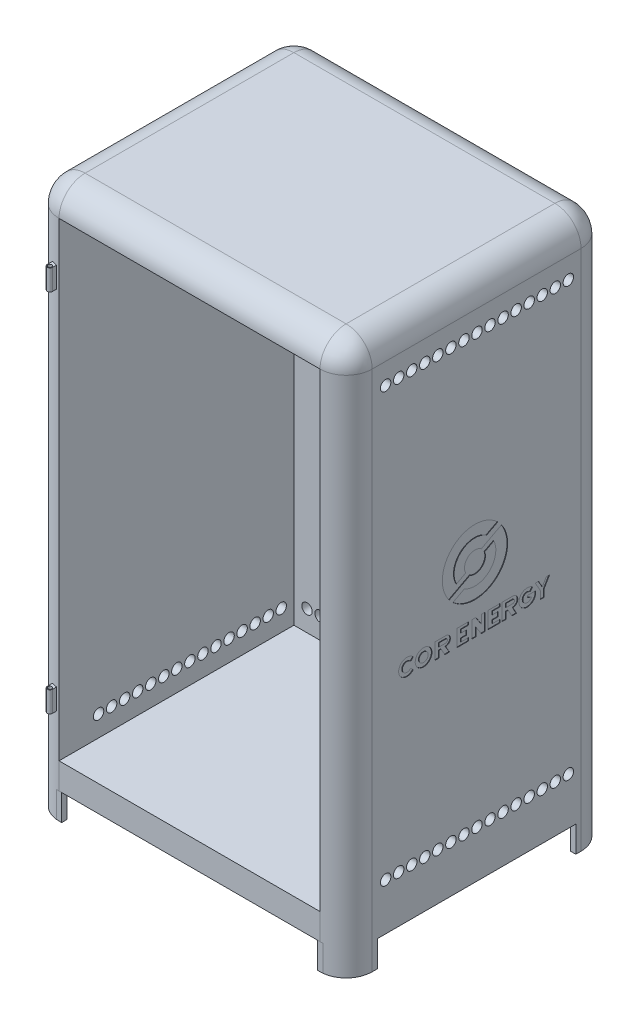
from build123d import *

# Parameters (mm, degrees)
BOSS_EXTRUDE1_DEPTH = 500
FILLET1_R           = 50
SKETCH2_W           = 500
SKETCH2_H           = 900
CUT_EXTRUDE1_DEPTH  = 450
BOSS_EXTRUDE2_START = -5
SKETCH3_W           = 27.5
SKETCH3_H           = 40
BOSS_EXTRUDE2_DEPTH = 10
BOSS_EXTRUDE4_DEPTH = 40
SKETCH6_R           = 3.75
CUT_EXTRUDE2_DEPTH  = 40
BOSS_EXTRUDE5_DEPTH = 50
SKETCH7_R           = 16.002178121
SKETCH7_R_2         = 8.764893155
CUT_EXTRUDE3_DEPTH  = 1
SKETCH8_R           = 10
CUT_EXTRUDE4_DEPTH  = 856.222924155
SKETCH9_R           = 10
CUT_EXTRUDE5_DEPTH  = 810.417228628


with BuildPart() as part:
    # Sketch1 → Boss-Extrude1 (new, symmetric)
    with BuildSketch(Plane(origin=(0, 0, 0), x_dir=(1, 0, 0), z_dir=(0, 1, 0))):
        with BuildLine():
            Line((250, -250), (-250, -250))
            ThreePointArc((-250, -250), (-285.355339059, -235.355339059), (-300, -200))
            Line((-300, -200), (-300, 200))
            ThreePointArc((-300, 200), (-285.355339059, 235.355339059), (-250, 250))
            Line((-250, 250), (250, 250))
            ThreePointArc((250, 250), (285.355339059, 235.355339059), (300, 200))
            Line((300, 200), (300, -200))
            ThreePointArc((300, -200), (285.355339059, -235.355339059), (250, -250))
        make_face()
    extrude(amount=BOSS_EXTRUDE1_DEPTH, both=True)

    # Fillet1
    fillet1_edges = [part.edges().sort_by_distance(p)[0] for p in [
        (285.355339059, 500, -235.355339059),
        (0, 500, -250),
        (-285.355339059, 500, -235.355339059),
        (-300, 500, 0),
        (-285.355339059, 500, 235.355339059),
        (0, 500, 250),
        (285.355339059, 500, 235.355339059),
        (300, 500, 0),
    ]]
    fillet(fillet1_edges, radius=FILLET1_R)

    # Sketch2 → Cut-Extrude1 (cut)
    with BuildSketch(Plane.XY.offset(250)):
        Rectangle(SKETCH2_W, SKETCH2_H)
    extrude(amount=-CUT_EXTRUDE1_DEPTH, mode=Mode.SUBTRACT)

    # Sketch3 → Boss-Extrude2 (add)
    with BuildSketch(Plane(origin=(-250, 0, 0), x_dir=(0, 0, -1), z_dir=(1, 0, 0)).offset(BOSS_EXTRUDE2_START)):
        with Locations((-243.75, 350)):
            Rectangle(SKETCH3_W, SKETCH3_H)
    boss_extrude2 = extrude(amount=-BOSS_EXTRUDE2_DEPTH)

    # Sketch5 → Boss-Extrude4 (add)
    with BuildSketch(Plane(origin=(0, 370, 0), x_dir=(1, 0, 0), z_dir=(0, 1, 0))):
        with BuildLine():
            Line((-265, -257.5), (-265, -252.5))
            Line((-265, -252.5), (-255, -252.5))
            Line((-255, -252.5), (-255, -257.5))
            ThreePointArc((-255, -257.5), (-260, -262.5), (-265, -257.5))
        make_face()
    boss_extrude4 = extrude(amount=-BOSS_EXTRUDE4_DEPTH)

    # Sketch6 → Cut-Extrude2 (cut)
    with BuildSketch(Plane(origin=(0, 370, 0), x_dir=(1, 0, 0), z_dir=(0, 1, 0))):
        with Locations(Location((-260, -257.5, 0), (0, 0, 270))):
            Circle(SKETCH6_R)
    cut_extrude2 = extrude(amount=-CUT_EXTRUDE2_DEPTH, mode=Mode.SUBTRACT)

    # Mirror1: Boss-Extrude2, Boss-Extrude4, Cut-Extrude2 across plane
    add(boss_extrude2.mirror(Plane.ZX))
    add(boss_extrude4.mirror(Plane.ZX))
    add(cut_extrude2.mirror(Plane.ZX), mode=Mode.SUBTRACT)

    # Sketch4 → Boss-Extrude5 (add)
    with BuildSketch(Plane.XZ.offset(500)):
        with BuildLine():
            Line((-300, 200), (-300, 190))
            Line((-300, 190), (-290, 190))
            Line((-290, 190), (-290, 200))
            ThreePointArc((-290, 200), (-278.284271247, 228.284271247), (-250, 240))
            Line((-250, 240), (-245.003141217, 240))
            Line((-245.003141217, 240), (-245.003141217, 250))
            Line((-245.003141217, 250), (-255, 249.749371855))
            ThreePointArc((-255, 249.749371855), (-287.080992435, 233.541019662), (-300, 200))
        make_face()
        with BuildLine():
            Line((290, 190), (300, 190))
            Line((300, 190), (300, 200))
            ThreePointArc((300, 200), (287.080992435, 233.541019662), (255, 249.749371855))
            Line((255, 249.749371855), (245.003141217, 250))
            Line((245.003141217, 250), (245.003141217, 240))
            Line((245.003141217, 240), (250, 240))
            ThreePointArc((250, 240), (278.284271247, 228.284271247), (290, 200))
            Line((290, 200), (290, 190))
        make_face()
        with BuildLine():
            Line((300, -200), (300, -190))
            Line((300, -190), (290, -190))
            Line((290, -190), (290, -200))
            ThreePointArc((290, -200), (278.284271247, -228.284271247), (250, -240))
            Line((250, -240), (245.003141217, -240))
            Line((245.003141217, -240), (245.003141217, -250))
            Line((245.003141217, -250), (255, -249.749371855))
            ThreePointArc((255, -249.749371855), (287.080992435, -233.541019662), (300, -200))
        make_face()
        with BuildLine():
            Line((-255, -249.749371855), (-245.003141217, -250))
            Line((-245.003141217, -250), (-245.003141217, -240))
            Line((-245.003141217, -240), (-250, -240))
            ThreePointArc((-250, -240), (-278.284271247, -228.284271247), (-290, -200))
            Line((-290, -200), (-290, -190))
            Line((-290, -190), (-300, -190))
            Line((-300, -190), (-300, -200))
            ThreePointArc((-300, -200), (-287.080992435, -233.541019662), (-255, -249.749371855))
        make_face()
    extrude(amount=BOSS_EXTRUDE5_DEPTH)

    # Sketch7 → Cut-Extrude3 (cut)
    # profile 1 of 10: a face of its own
    with BuildSketch(Plane(origin=(300, 0, 0), x_dir=(0, 0, -1), z_dir=(1, 0, 0))):
        with Locations((-101.62512665, -77.408667629)):
            Circle(SKETCH7_R)
        with Locations((-101.62512665, -77.408667629)):
            Circle(SKETCH7_R_2, mode=Mode.SUBTRACT)
    # profile 2 of 10: a face of its own
    with BuildSketch(Plane(origin=(300, 0, 0), x_dir=(0, 0, -1), z_dir=(1, 0, 0))):
        with BuildLine():
            Line((-79.919015614, -62.785778955), (-79.919015614, -93.41084575))
            Line((-79.919015614, -93.41084575), (-72.419015614, -93.41084575))
            Line((-72.419015614, -93.41084575), (-72.419015614, -80.59834575))
            Line((-72.419015614, -80.59834575), (-68.019625147, -80.59834575))
            Line((-68.019625147, -80.59834575), (-60.84333251, -93.41084575))
            Line((-60.84333251, -93.41084575), (-52.09333251, -93.41084575))
            Line((-52.09333251, -93.41084575), (-59.269625147, -80.59834575))
            ThreePointArc((-59.269625147, -80.59834575), (-50.363341749, -71.692062352), (-59.269625147, -62.785778955))
            Line((-59.269625147, -62.785778955), (-79.919015614, -62.785778955))
        make_face()
        with BuildLine():
            Line((-59.269625147, -75.09834575), (-72.419015614, -75.09834575))
            Line((-72.419015614, -75.09834575), (-72.419015614, -68.285778955))
            Line((-72.419015614, -68.285778955), (-59.269625147, -68.285778955))
            ThreePointArc((-59.269625147, -68.285778955), (-55.863341749, -71.692062352), (-59.269625147, -75.09834575))
        make_face(mode=Mode.SUBTRACT)
    # profile 3 of 10: a face of its own
    with BuildSketch(Plane(origin=(300, 0, 0), x_dir=(0, 0, -1), z_dir=(1, 0, 0))):
        Polygon((-18.957125147, -73.033667629), (-18.957125147, -81.783667629), (-29.894625147, -81.783667629), (-29.894625147, -87.777171882), (-15.207125147, -87.777171882), (-15.207125147, -93.41084575), (-37.707125147, -93.41084575), (-37.707125147, -61.406489508), (-15.207125147, -61.406489508), (-15.207125147, -67.040163376), (-29.894625147, -67.040163376), (-29.894625147, -73.033667629), align=None)
    # profile 4 of 10: a face of its own
    with BuildSketch(Plane(origin=(300, 0, 0), x_dir=(0, 0, -1), z_dir=(1, 0, 0))):
        Polygon((44.669753756, -93.41084575), (44.669753756, -87.535225783), (29.982253756, -87.535225783), (29.982253756, -81.54172153), (40.919753756, -81.54172153), (40.919753756, -72.79172153), (29.982253756, -72.79172153), (29.982253756, -66.798217277), (44.669753756, -66.798217277), (44.669753756, -61.406489508), (22.169753756, -61.406489508), (22.169753756, -93.41084575), align=None)
    # profile 5 of 10: a face of its own
    with BuildSketch(Plane(origin=(300, 0, 0), x_dir=(0, 0, -1), z_dir=(1, 0, 0))):
        with BuildLine():
            Line((67.61708546, -93.41084575), (60.440792823, -80.59834575))
            Line((60.440792823, -80.59834575), (56.041402355, -80.59834575))
            Line((56.041402355, -80.59834575), (56.041402355, -93.41084575))
            Line((56.041402355, -93.41084575), (48.541402355, -93.41084575))
            Line((48.541402355, -93.41084575), (48.541402355, -61.335572011))
            Line((48.541402355, -61.335572011), (69.190792823, -61.335572011))
            ThreePointArc((69.190792823, -61.335572011), (78.822179692, -70.966958881), (69.190792823, -80.59834575))
            Line((69.190792823, -80.59834575), (76.36708546, -93.41084575))
            Line((76.36708546, -93.41084575), (67.61708546, -93.41084575))
        make_face()
        with BuildLine():
            Line((69.190792823, -73.854137749), (56.041402355, -73.854137749))
            Line((56.041402355, -73.854137749), (56.041402355, -67.041570954))
            Line((56.041402355, -67.041570954), (69.190792823, -67.041570954))
            ThreePointArc((69.190792823, -67.041570954), (72.597076221, -70.447854352), (69.190792823, -73.854137749))
        make_face(mode=Mode.SUBTRACT)
    # profile 6 of 10: a face of its own
    with BuildSketch(Plane(origin=(300, 0, 0), x_dir=(0, 0, -1), z_dir=(1, 0, 0))):
        Polygon((-8.953859328, -61.406489508), (-1.453859328, -61.406489508), (8.996860653, -77.408667629), (8.996860653, -61.404963748), (16.496860653, -61.404963748), (16.496860653, -93.41084575), (8.996860653, -93.41084575), (-1.453859328, -77.408667629), (-1.453859328, -93.41084575), (-8.953859328, -93.41084575), align=None)
    # profile 7 of 10: a face of its own
    with BuildSketch(Plane(origin=(300, 0, 0), x_dir=(0, 0, -1), z_dir=(1, 0, 0))):
        with BuildLine():
            Line((97.070626041, -77.408667629), (105.01106712, -80.892653845))
            ThreePointArc((105.01106712, -80.892653845), (88.641715559, -79.443915173), (102.546372912, -70.685204184))
            Line((102.546372912, -70.685204184), (107.175851083, -65.000842217))
            ThreePointArc((107.175851083, -65.000842217), (82.617679703, -84.277586523), (113.072804162, -77.408667629))
            ThreePointArc((113.072804162, -77.408667629), (112.996688878, -75.849749051), (112.769067119, -74.305660645))
            Line((112.769067119, -74.305660645), (97.070626041, -74.305660645))
            Line((97.070626041, -74.305660645), (97.070626041, -77.408667629))
        make_face()
    # profile 8 of 10: a face of its own
    with BuildSketch(Plane(origin=(300, 0, 0), x_dir=(0, 0, -1), z_dir=(1, 0, 0))):
        Polygon((139.541684525, -61.335572011), (133.291684525, -61.335572011), (125.902023815, -74.134839811), (118.512363106, -61.335572011), (112.262363106, -61.335572011), (122.777023815, -79.547498585), (122.777023815, -93.41084575), (129.027023815, -93.41084575), (129.027023815, -79.547498585), align=None)
    # profile 9 of 10: a face of its own
    with BuildSketch(Plane(origin=(300, 0, 0), x_dir=(0, 0, -1), z_dir=(1, 0, 0))):
        with BuildLine():
            Line((18.968076824, 64.732129033), (40.473047286, 76.138441831))
            ThreePointArc((40.473047286, 76.138441831), (-44.836432892, 78.086826448), (-52.578587253, -6.892951481))
            Line((-52.578587253, -6.892951481), (-13.086572974, 14.053753313))
            ThreePointArc((-13.086572974, 14.053753313), (10.006219576, 16.454910705), (15.269194077, 39.067821265))
            Line((15.269194077, 39.067821265), (32.979375567, 48.461364498))
            ThreePointArc((32.979375567, 48.461364498), (23.719063751, 1.8889381), (-23.51054105, -3.021123595))
            Line((-23.51054105, -3.021123595), (-45.427711042, -14.646068488))
            ThreePointArc((-45.427711042, -14.646068488), (38.211198676, -15.337128204), (47.640334257, 67.771452487))
            Line((47.640334257, 67.771452487), (9.00446579, 47.278850476))
            ThreePointArc((9.00446579, 47.278850476), (-16.113296837, 46.746279137), (-20.893016882, 22.081731544))
            Line((-20.893016882, 22.081731544), (-38.56152372, 12.710292694))
            ThreePointArc((-38.56152372, 12.710292694), (-30.052887801, 61.121978037), (18.968076824, 64.732129033))
        make_face()
    # profile 10 of 10: a face of its own
    with BuildSketch(Plane(origin=(300, 0, 0), x_dir=(0, 0, -1), z_dir=(1, 0, 0))):
        with BuildLine():
            Line((-126.426872889, -83.093800912), (-121.461170207, -88.059503594))
            ThreePointArc((-121.461170207, -88.059503594), (-149.406103364, -77.408667629), (-121.461170207, -66.757831664))
            Line((-121.461170207, -66.757831664), (-126.426872889, -71.723534346))
            ThreePointArc((-126.426872889, -71.723534346), (-142.403925243, -77.408667629), (-126.426872889, -83.093800912))
        make_face()
    extrude(amount=-CUT_EXTRUDE3_DEPTH, mode=Mode.SUBTRACT)

    # Sketch8 → Cut-Extrude4 (cut, through all)
    with BuildSketch(Plane(origin=(300, 0, 0), x_dir=(0, 0, -1), z_dir=(1, 0, 0))):
        with Locations((-174.297768053, 410)):
            Circle(SKETCH8_R)
        with Locations((-149.297768053, 410)):
            Circle(SKETCH8_R)
        with Locations((-124.297768053, 410)):
            Circle(SKETCH8_R)
        with Locations((-99.297768053, 410)):
            Circle(SKETCH8_R)
        with Locations((-74.297768053, 410)):
            Circle(SKETCH8_R)
        with Locations((-49.297768053, 410)):
            Circle(SKETCH8_R)
        with Locations((-24.297768053, 410)):
            Circle(SKETCH8_R)
        with Locations((0.702231947, 410)):
            Circle(SKETCH8_R)
        with Locations((25.702231947, 410)):
            Circle(SKETCH8_R)
        with Locations((50.702231947, 410)):
            Circle(SKETCH8_R)
        with Locations((75.702231947, 410)):
            Circle(SKETCH8_R)
        with Locations((100.702231947, 410)):
            Circle(SKETCH8_R)
        with Locations((125.702231947, 410)):
            Circle(SKETCH8_R)
        with Locations((150.702231947, 410)):
            Circle(SKETCH8_R)
        with Locations((175.702231947, 410)):
            Circle(SKETCH8_R)
        with Locations((175.702231947, -410)):
            Circle(SKETCH8_R)
        with Locations((150.702231947, -410)):
            Circle(SKETCH8_R)
        with Locations((125.702231947, -410)):
            Circle(SKETCH8_R)
        with Locations((100.702231947, -410)):
            Circle(SKETCH8_R)
        with Locations((75.702231947, -410)):
            Circle(SKETCH8_R)
        with Locations((50.702231947, -410)):
            Circle(SKETCH8_R)
        with Locations((25.702231947, -410)):
            Circle(SKETCH8_R)
        with Locations((0.702231947, -410)):
            Circle(SKETCH8_R)
        with Locations((-24.297768053, -410)):
            Circle(SKETCH8_R)
        with Locations((-49.297768053, -410)):
            Circle(SKETCH8_R)
        with Locations((-74.297768053, -410)):
            Circle(SKETCH8_R)
        with Locations((-99.297768053, -410)):
            Circle(SKETCH8_R)
        with Locations((-124.297768053, -410)):
            Circle(SKETCH8_R)
        with Locations((-149.297768053, -410)):
            Circle(SKETCH8_R)
        with Locations((-174.297768053, -410)):
            Circle(SKETCH8_R)
    extrude(amount=-CUT_EXTRUDE4_DEPTH, mode=Mode.SUBTRACT)

    # Sketch9 → Cut-Extrude5 (cut, through all)
    with BuildSketch(Plane(origin=(0, 0, -250), x_dir=(-1, 0, 0), z_dir=(0, 0, -1))):
        with Locations((-225.056040646, 410)):
            Circle(SKETCH9_R)
        with Locations((-200.056040646, 410)):
            Circle(SKETCH9_R)
        with Locations((-175.056040646, 410)):
            Circle(SKETCH9_R)
        with Locations((-150.056040646, 410)):
            Circle(SKETCH9_R)
        with Locations((-125.056040646, 410)):
            Circle(SKETCH9_R)
        with Locations((-100.056040646, 410)):
            Circle(SKETCH9_R)
        with Locations((-75.056040646, 410)):
            Circle(SKETCH9_R)
        with Locations((-50.056040646, 410)):
            Circle(SKETCH9_R)
        with Locations((-25.056040646, 410)):
            Circle(SKETCH9_R)
        with Locations((-0.056040646, 410)):
            Circle(SKETCH9_R)
        with Locations((24.943959354, 410)):
            Circle(SKETCH9_R)
        with Locations((49.943959354, 410)):
            Circle(SKETCH9_R)
        with Locations((74.943959354, 410)):
            Circle(SKETCH9_R)
        with Locations((99.943959354, 410)):
            Circle(SKETCH9_R)
        with Locations((124.943959354, 410)):
            Circle(SKETCH9_R)
        with Locations((149.943959354, 410)):
            Circle(SKETCH9_R)
        with Locations((174.943959354, 410)):
            Circle(SKETCH9_R)
        with Locations((199.943959354, 410)):
            Circle(SKETCH9_R)
        with Locations((224.943959354, 410)):
            Circle(SKETCH9_R)
        with Locations(Location((224.943959354, -410, 0), (0, 0, 180))):
            Circle(SKETCH9_R)
        with Locations(Location((199.943959354, -410, 0), (0, 0, 180))):
            Circle(SKETCH9_R)
        with Locations(Location((174.943959354, -410, 0), (0, 0, 180))):
            Circle(SKETCH9_R)
        with Locations(Location((149.943959354, -410, 0), (0, 0, 180))):
            Circle(SKETCH9_R)
        with Locations(Location((124.943959354, -410, 0), (0, 0, 180))):
            Circle(SKETCH9_R)
        with Locations(Location((99.943959354, -410, 0), (0, 0, 180))):
            Circle(SKETCH9_R)
        with Locations(Location((74.943959354, -410, 0), (0, 0, 180))):
            Circle(SKETCH9_R)
        with Locations(Location((49.943959354, -410, 0), (0, 0, 180))):
            Circle(SKETCH9_R)
        with Locations(Location((24.943959354, -410, 0), (0, 0, 180))):
            Circle(SKETCH9_R)
        with Locations(Location((-0.056040646, -410, 0), (0, 0, 180))):
            Circle(SKETCH9_R)
        with Locations(Location((-25.056040646, -410, 0), (0, 0, 180))):
            Circle(SKETCH9_R)
        with Locations(Location((-50.056040646, -410, 0), (0, 0, 180))):
            Circle(SKETCH9_R)
        with Locations(Location((-75.056040646, -410, 0), (0, 0, 180))):
            Circle(SKETCH9_R)
        with Locations(Location((-100.056040646, -410, 0), (0, 0, 180))):
            Circle(SKETCH9_R)
        with Locations(Location((-125.056040646, -410, 0), (0, 0, 180))):
            Circle(SKETCH9_R)
        with Locations(Location((-150.056040646, -410, 0), (0, 0, 180))):
            Circle(SKETCH9_R)
        with Locations(Location((-175.056040646, -410, 0), (0, 0, 180))):
            Circle(SKETCH9_R)
        with Locations(Location((-200.056040646, -410, 0), (0, 0, 180))):
            Circle(SKETCH9_R)
        with Locations(Location((-225.056040646, -410, 0), (0, 0, 180))):
            Circle(SKETCH9_R)
    extrude(amount=-CUT_EXTRUDE5_DEPTH, mode=Mode.SUBTRACT)


solid = part.part
